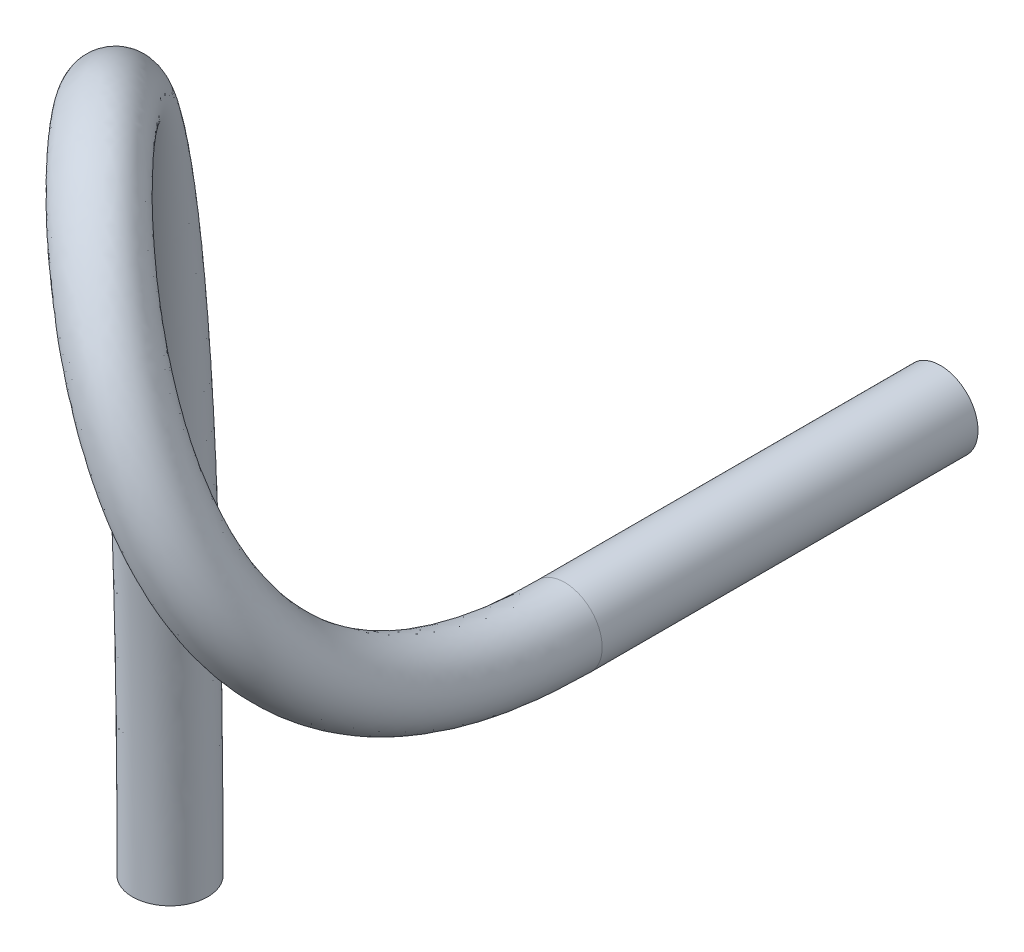
from build123d import *

# Parameters (mm, degrees)
SKIZZE1_R                       = 1
SKIZZE1_R_2                     = 0.75
SKIZZE3_R                       = 1
SKIZZE3_R_2                     = 0.75
AUFSATZ_LINEAR_AUSTRAGEN1_DEPTH = 10


with BuildPart() as part:
    # Austragung1: sweep along a curve in space
    with BuildLine() as austragung1_path:
        add(Edge.make_bspline(
            [(0, 0, 0), (0, 41.618884591, 0), (10.5, 11, 18.975980575), (10.5, 11, 0)],
            knots=[0, 0, 0, 0, 1, 1, 1, 1], degree=3))
    # Skizze1 → Austragung1 (sweep)
    with BuildSketch(Plane(origin=(0, 0, 0), x_dir=(1, 0, 0), z_dir=(0, 1, 0))):
        Circle(SKIZZE1_R)
        Circle(SKIZZE1_R_2, mode=Mode.SUBTRACT)
    sweep(path=austragung1_path.line)

    # Skizze3 → Aufsatz-Linear austragen1 (add)
    with BuildSketch(Plane(origin=(0, 0, 0), x_dir=(-1, 0, 0), z_dir=(0, 0, -1))):
        with Locations(Location((-10.5, 11, 0), (0, 0, 42.114725711))):
            Circle(SKIZZE3_R)
        with Locations(Location((-10.5, 11, 0), (0, 0, 42.114725711))):
            Circle(SKIZZE3_R_2, mode=Mode.SUBTRACT)
    extrude(amount=AUFSATZ_LINEAR_AUSTRAGEN1_DEPTH)


solid = part.part
